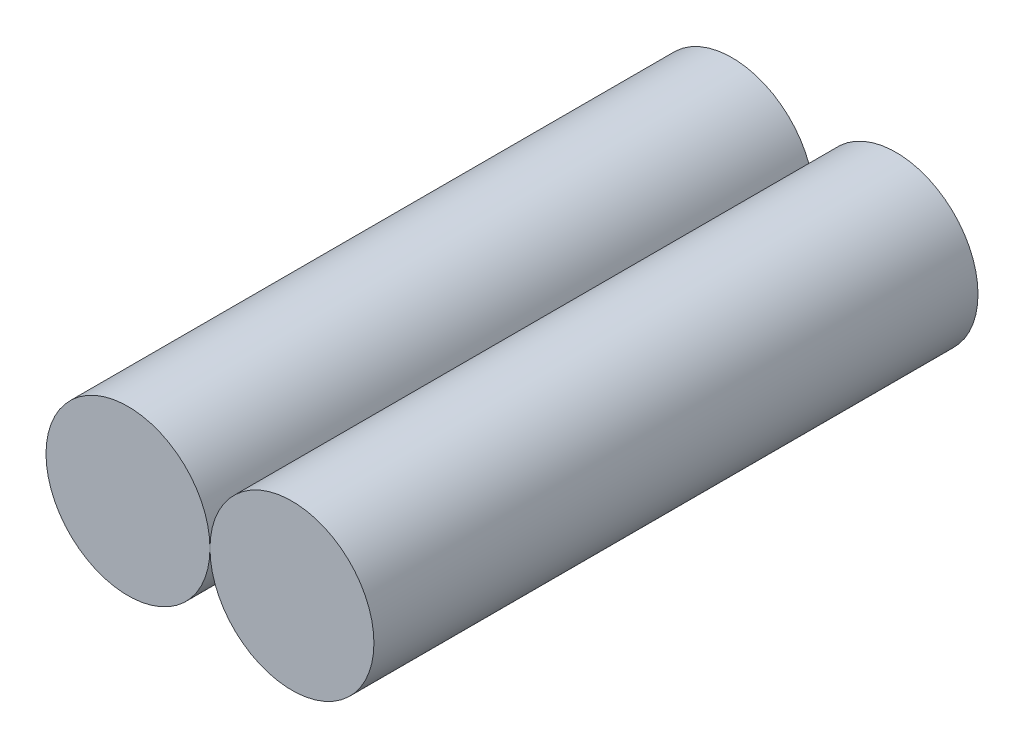
from build123d import *

# Parameters (mm, degrees)
BOSS_EXTRUDE1_DEPTH        = 35
BOSS_EXTRUDE1_DEPTH_BACK   = 35
BOSS_EXTRUDE1_2_DEPTH      = 35
BOSS_EXTRUDE1_2_DEPTH_BACK = 35
SKETCH1_R                  = 9.5


with BuildPart() as part:
    # Sketch1 → Boss-Extrude1 (new, two sides: drawn at the far end of the back side and taken through both)
    with BuildSketch(Plane.XY.offset(-BOSS_EXTRUDE1_DEPTH_BACK)):
        with BuildLine():
            ThreePointArc((-9.5, 0), (0, -9.5), (9.5, 0))
            ThreePointArc((9.5, 0), (0, 9.5), (-9.5, 0))
        make_face()
    extrude(amount=BOSS_EXTRUDE1_DEPTH + BOSS_EXTRUDE1_DEPTH_BACK)


with BuildPart() as body_2:
    # Sketch1 → Boss-Extrude1 2 (new, two sides: drawn at the far end of the back side and taken through both)
    with BuildSketch(Plane.XY.offset(-BOSS_EXTRUDE1_2_DEPTH_BACK)):
        with Locations((-19, 0)):
            Circle(SKETCH1_R)
    extrude(amount=BOSS_EXTRUDE1_2_DEPTH + BOSS_EXTRUDE1_2_DEPTH_BACK)


solid = Compound([part.part, body_2.part])
